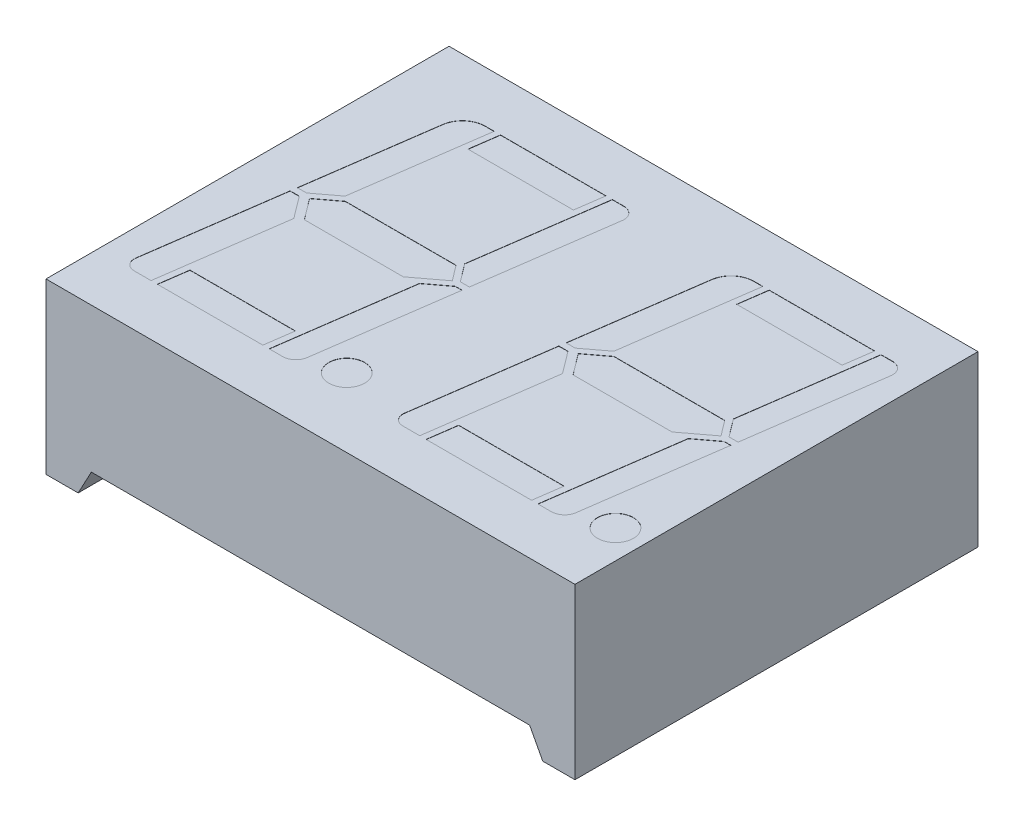
from build123d import *

# Parameters (mm, degrees)
SKETCH1_W           = 25
SKETCH1_H           = 19.05
BOSS_EXTRUDE1_DEPTH = 8
CUT_EXTRUDE1_DEPTH  = 25.148550681
SKETCH3_R           = 0.85
CUT_EXTRUDE3_DEPTH  = 0.01
LPATTERN2_COUNT     = 2
LPATTERN2_PITCH     = 12.7


with BuildPart() as part:
    # Sketch1 → Boss-Extrude1 (new body)
    with BuildSketch(Plane(origin=(0, 0, 0), x_dir=(1, 0, 0), z_dir=(0, 1, 0))):
        Rectangle(SKETCH1_W, SKETCH1_H)
    extrude(amount=BOSS_EXTRUDE1_DEPTH)

    # Sketch2 → Cut-Extrude1 (cut, through all)
    with BuildSketch(Plane.XY.offset(9.525)):
        Polygon((-10.357683229, 1.165391541), (-10.979622637, 0), (10.979622637, 0), (10.357683229, 1.165391541), align=None)
    extrude(amount=-CUT_EXTRUDE1_DEPTH, mode=Mode.SUBTRACT)

    # Sketch3 → Cut-Extrude3 (cut)
    with BuildSketch(Plane(origin=(0, 8, 0), x_dir=(1, 0, 0), z_dir=(0, 1, 0))):
        with Locations(Location((-1.55, -6.26, 0), (0, 0, 270))):
            Circle(SKETCH3_R)
        with BuildLine():
            Line((-10.293918875, 0.15), (-9.446582946, 6.179108414))
            ThreePointArc((-9.446582946, 6.179108414), (-9.085171861, 6.844744827), (-8.375714675, 7.11))
            Line((-8.375714675, 7.11), (-7.952487442, 7.11))
            Line((-7.952487442, 7.11), (-8.820313991, 0.935093249))
            Line((-8.820313991, 0.935093249), (-9.862167922, 0.15))
            Line((-9.862167922, 0.15), (-10.293918875, 0.15))
        make_face()
        with BuildLine():
            Line((-2.367186588, 7.11), (-1.813478843, 7.11))
            ThreePointArc((-1.813478843, 7.11), (-1.401654728, 6.922320938), (-1.273116986, 6.488384791))
            Line((-1.273116986, 6.488384791), (-2.163918875, 0.15))
            Line((-2.163918875, 0.15), (-2.593918875, 0.15))
            Line((-2.593918875, 0.15), (-3.227234844, 0.990438678))
            Line((-3.227234844, 0.990438678), (-2.367186588, 7.11))
        make_face()
        Polygon((-7.652487442, 7.11), (-2.667186588, 7.11), (-2.856916715, 5.76), (-7.842217569, 5.76), align=None)
        Polygon((-8.604632176, 0.726571417), (-3.369972607, 0.726571417), (-2.822461773, 0), (-4.142522346, -0.994736992), (-8.819236923, -0.994736992), (-9.568825012, 0), align=None)
        with BuildLine():
            Line((-10.336081125, -0.15), (-9.904330172, -0.15))
            Line((-9.904330172, -0.15), (-9.119236923, -1.191853931))
            Line((-9.119236923, -1.191853931), (-9.950978112, -7.11))
            Line((-9.950978112, -7.11), (-10.750461652, -7.11))
            ThreePointArc((-10.750461652, -7.11), (-11.120337027, -6.94143808), (-11.235781811, -6.551703021))
            Line((-11.235781811, -6.551703021), (-10.336081125, -0.15))
        make_face()
        Polygon((-9.650978112, -7.11), (-4.665677257, -7.11), (-4.47594713, -5.76), (-9.461247985, -5.76), align=None)
        with BuildLine():
            Line((-2.206081125, -0.15), (-3.108270084, -6.569408002))
            ThreePointArc((-3.108270084, -6.569408002), (-3.318150529, -6.955959695), (-3.730150039, -7.11))
            Line((-3.730150039, -7.11), (-4.365677257, -7.11))
            Line((-4.365677257, -7.11), (-3.489911075, -0.878599823))
            Line((-3.489911075, -0.878599823), (-2.523026453, -0.15))
            Line((-2.523026453, -0.15), (-2.206081125, -0.15))
        make_face()
    cut_extrude3 = extrude(amount=-CUT_EXTRUDE3_DEPTH, mode=Mode.SUBTRACT)

    # LPattern2: Cut-Extrude3 ×2
    with Locations(*[(i * LPATTERN2_PITCH, 0, 0) for i in range(1, LPATTERN2_COUNT)]):
        add(cut_extrude3, mode=Mode.SUBTRACT)


solid = part.part
